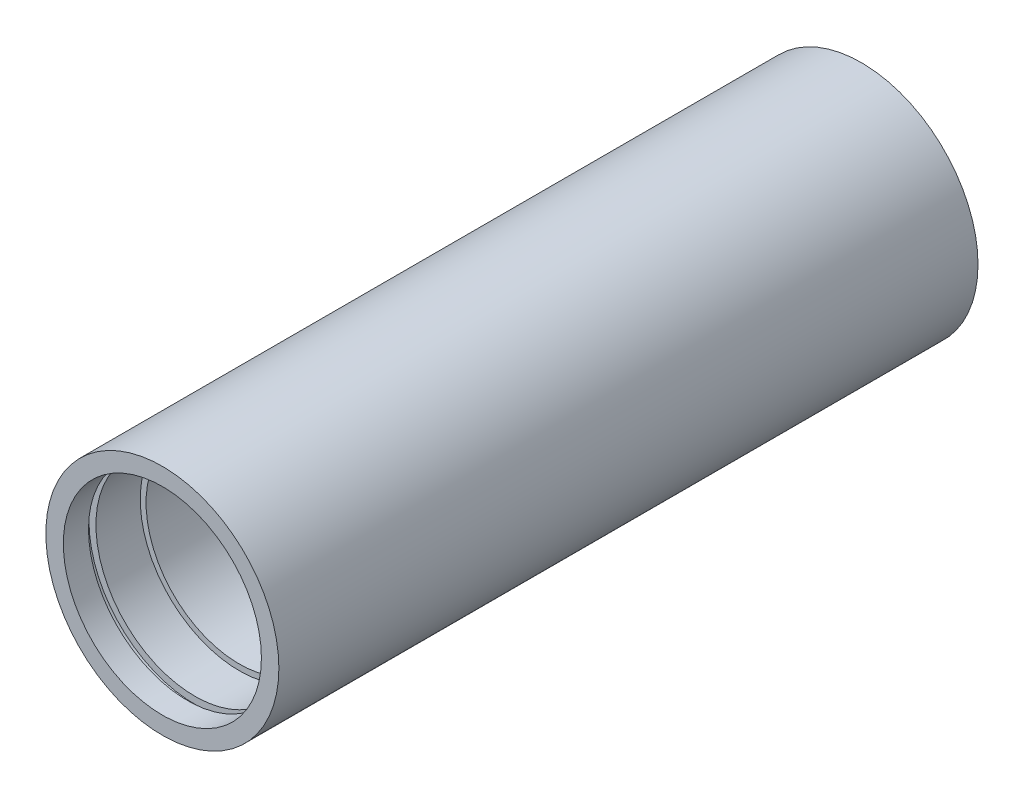
from build123d import *

# Parameters (mm, degrees)
SKETCH1_R           = 50
BOSS_EXTRUDE1_DEPTH = 150
SKETCH2_R           = 42.5
CUT_EXTRUDE1_DEPTH  = 33
SKETCH3_R           = 40
CUT_EXTRUDE2_DEPTH  = 277.204634284
SKETCH4_W           = 10
SKETCH4_H           = 3.2


with BuildPart() as part:
    # Sketch1 → Boss-Extrude1 (new, symmetric)
    with BuildSketch(Plane.XY):
        Circle(SKETCH1_R)
    extrude(amount=BOSS_EXTRUDE1_DEPTH, both=True)

    # Sketch2 → Cut-Extrude1 (cut)
    with BuildSketch(Plane.XY.offset(150)):
        Circle(SKETCH2_R)
    cut_extrude1 = extrude(amount=-CUT_EXTRUDE1_DEPTH, mode=Mode.SUBTRACT)

    # Sketch3 → Cut-Extrude2 (cut, through all)
    with BuildSketch(Plane.XY.offset(117)):
        Circle(SKETCH3_R)
    cut_extrude2 = extrude(amount=-CUT_EXTRUDE2_DEPTH, mode=Mode.SUBTRACT)

    # Sketch4 → Cut-Revolve1 (revolve, cut)
    with BuildSketch(Plane(origin=(0, 0, 0), x_dir=(1, 0, 0), z_dir=(0, 1, 0))):
        with Locations((40.5, -137.6)):
            Rectangle(SKETCH4_W, SKETCH4_H)
    cut_revolve1 = revolve(axis=Axis((0, 0, 150), (0, 0, 1)), mode=Mode.SUBTRACT)

    # Mirror1: Cut-Extrude1, Cut-Extrude2, Cut-Revolve1 across plane
    add(cut_extrude1.mirror(Plane.XY), mode=Mode.SUBTRACT)
    add(cut_extrude2.mirror(Plane.XY), mode=Mode.SUBTRACT)
    add(cut_revolve1.mirror(Plane.XY), mode=Mode.SUBTRACT)


solid = part.part
